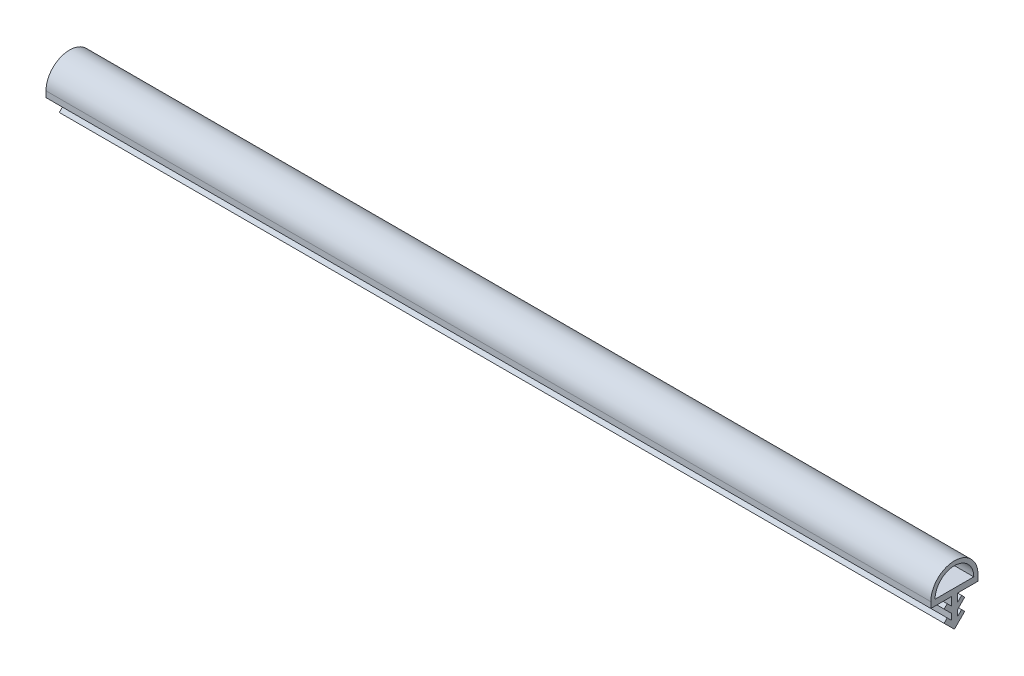
from build123d import *

# Parameters (mm, degrees)
EXTRUDE_2_DEPTH      = 75
EXTRUDE_2_DEPTH_BACK = 75


with BuildPart() as part:
    # 草图1<2> → 凸台-拉伸2 (new, two sides: drawn at the far end of the back side and taken through both)
    with BuildSketch(Plane(origin=(0, 0, 0), x_dir=(0, 0, -1), z_dir=(1, 0, 0)).offset(-EXTRUDE_2_DEPTH_BACK)):
        with BuildLine():
            Line((-4, 0), (-0.5, 0))
            Line((-0.5, 0), (-0.5, -1.406748669))
            Line((-0.5, -1.406748669), (-1.219669914, -0.687078754))
            Line((-1.219669914, -0.687078754), (-1.75, -1.21740884))
            Line((-1.75, -1.21740884), (-0.5, -2.46740884))
            Line((-0.5, -2.46740884), (-0.5, -3.49335212))
            Line((-0.5, -3.49335212), (-1.219669914, -2.773682206))
            Line((-1.219669914, -2.773682206), (-1.75, -3.304012292))
            Line((-1.75, -3.304012292), (0, -5.054012292))
            Line((0, -5.054012292), (1.75, -3.304012292))
            Line((1.75, -3.304012292), (1.219669914, -2.773682206))
            Line((1.219669914, -2.773682206), (0.5, -3.49335212))
            Line((0.5, -3.49335212), (0.5, -2.46740884))
            Line((0.5, -2.46740884), (1.75, -1.21740884))
            Line((1.75, -1.21740884), (1.219669914, -0.687078754))
            Line((1.219669914, -0.687078754), (0.5, -1.406748669))
            Line((0.5, -1.406748669), (0.5, 0))
            Line((0.5, 0), (4, 0))
            Line((4, 0), (4, 1))
            ThreePointArc((4, 1), (0, 5), (-4, 1))
            Line((-4, 1), (-4, 0))
        make_face()
        with BuildLine():
            Line((3.282029094, 1), (-3.282029094, 1))
            ThreePointArc((-3.282029094, 1), (0, 4.282029094), (3.282029094, 1))
        make_face(mode=Mode.SUBTRACT)
    extrude(amount=EXTRUDE_2_DEPTH + EXTRUDE_2_DEPTH_BACK)


solid = part.part
